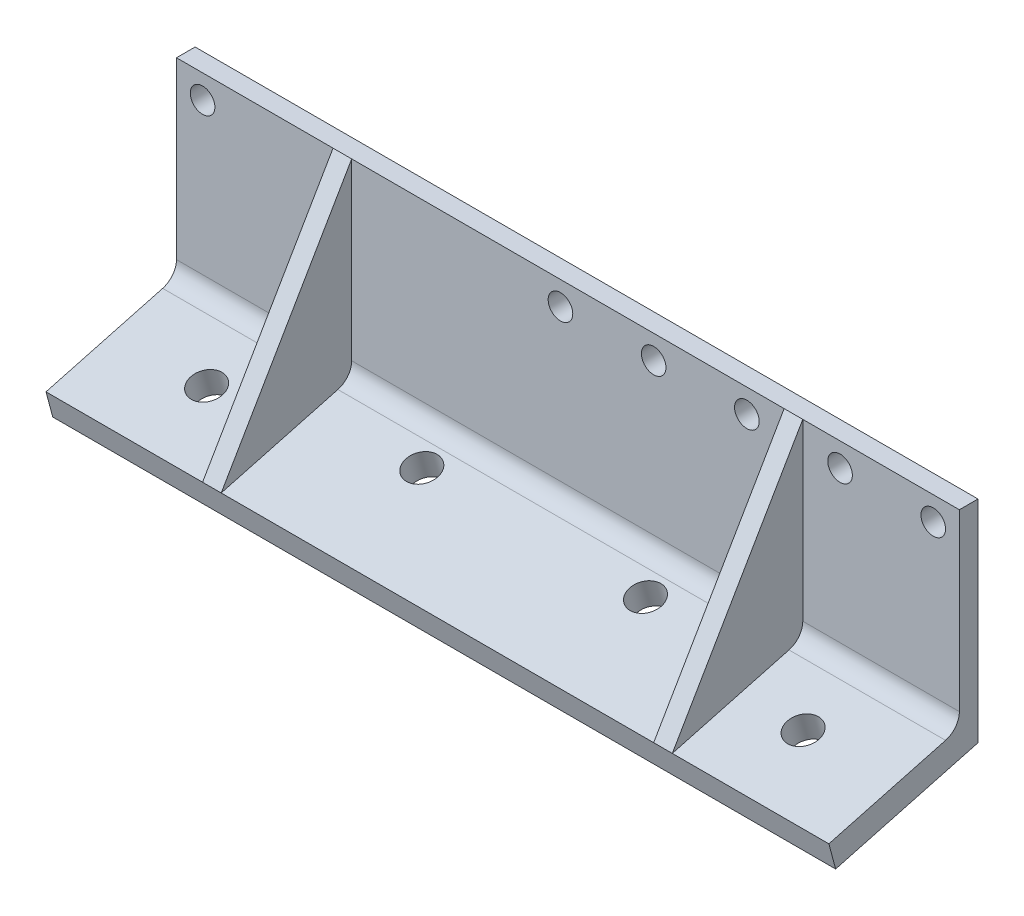
from build123d import *

# Parameters (mm, degrees)
EXTRUDE_1_DEPTH      = 30
SKETCH_2_R           = 44.45
CUT_EXTRUDE_1_DEPTH  = 4
SKETCH_3_R           = 25.5
SKETCH_3_R_2         = 2.25
CUT_EXTRUDE_2_DEPTH  = 188.619295383
CUT_EXTRUDE_3_DEPTH  = 189.215302247
SKETCH_5_R           = 1.65
CUT_EXTRUDE_4_DEPTH  = 189.215302247
EXTRUDE_START        = -30
EXTRUDE_2_DEPTH      = 30
CUT_EXTRUDE_5_DEPTH  = 198.040604952
CUT_EXTRUDE_7_DEPTH  = 233.432785983
CUT_EXTRUDE_8_DEPTH  = 233.432785983
CUT_EXTRUDE_9_DEPTH  = 233.432785983
FILLET_1_R           = 5
CUT_EXTRUDE_10_DEPTH = 233.432785983
EXTRUDE_START_2      = -5
EXTRUDE_3_DEPTH      = 5
EXTRUDE_4_DEPTH      = 5
SKETCH_14_R          = 4.25
CUT_EXTRUDE_11_DEPTH = 189.364728478
SKETCH_16_W          = 43
SKETCH_16_H          = 30
CUT_EXTRUDE_12_DEPTH = 233.432785983
EXTRUDE_7_REACH      = 188.592
SKETCH_18_W          = 210
SKETCH_18_H          = 5
EXTRUDE_8_DEPTH      = 210
EXTRUDE_9_DEPTH      = 5
EXTRUDE_10_DEPTH     = 5
SKETCH_22_R          = 4.25
CUT_EXTRUDE_13_DEPTH = 187.984035343
FILLET_2_R           = 5
SKETCH_23_W          = 158.512158041
SKETCH_23_H          = 103.317713915
CUT_EXTRUDE_14_DEPTH = 234.418610938
EXTRUDE_11_DEPTH     = 2.5
EXTRUDE_12_DEPTH     = 2.5
CUT_EXTRUDE_15_DEPTH = 5
CUT_EXTRUDE_START    = -5
CUT_EXTRUDE_16_DEPTH = 5
SKETCH_24_R          = 3.3
CUT_EXTRUDE_17_DEPTH = 166.976648756


with BuildPart() as part:
    # 草图1 → 凸台-拉伸1 (new body)
    with BuildSketch(Plane(origin=(0, 0, 0), x_dir=(1, 0, 0), z_dir=(0, 1, 0))):
        with BuildLine():
            Line((170, 31.93), (170, -31.93))
            ThreePointArc((170, -31.93), (167.781993847, -38.210172909), (162.111885646, -41.704453387))
            Line((162.111885646, -41.704453387), (15.839142344, -73.308400404))
            ThreePointArc((15.839142344, -73.308400404), (-75, 0), (15.839142344, 73.308400404))
            Line((15.839142344, 73.308400404), (162.111885646, 41.704453387))
            ThreePointArc((162.111885646, 41.704453387), (167.781993847, 38.210172909), (170, 31.93))
        make_face()
    extrude(amount=EXTRUDE_1_DEPTH)

    # 草图2 → 切除-拉伸1 (cut)
    with BuildSketch(Plane(origin=(0, 30, 0), x_dir=(1, 0, 0), z_dir=(0, 1, 0))):
        with Locations(Location((0, 0, 0), (0, 0, 270))):
            Circle(SKETCH_2_R)
    extrude(amount=-CUT_EXTRUDE_1_DEPTH, mode=Mode.SUBTRACT)

    # 草图3 → 切除-拉伸2 (cut, through all)
    with BuildSketch(Plane(origin=(0, 26, 0), x_dir=(1, 0, 0), z_dir=(0, 1, 0))):
        with Locations(Location((0, 0, 0), (0, 0, 270))):
            Circle(SKETCH_3_R)
        with Locations(Location((0, 41, 0), (0, 0, 270))):
            Circle(SKETCH_3_R_2)
        with Locations(Location((28.991378029, 28.991378029, 0), (0, 0, 270))):
            Circle(SKETCH_3_R_2)
        with Locations(Location((41, 0, 0), (0, 0, 270))):
            Circle(SKETCH_3_R_2)
        with Locations(Location((28.991378029, -28.991378029, 0), (0, 0, 270))):
            Circle(SKETCH_3_R_2)
        with Locations(Location((0, -41, 0), (0, 0, 270))):
            Circle(SKETCH_3_R_2)
        with Locations(Location((-28.991378029, -28.991378029, 0), (0, 0, 270))):
            Circle(SKETCH_3_R_2)
        with Locations(Location((-41, 0, 0), (0, 0, 270))):
            Circle(SKETCH_3_R_2)
        with Locations(Location((-28.991378029, 28.991378029, 0), (0, 0, 270))):
            Circle(SKETCH_3_R_2)
    extrude(amount=-CUT_EXTRUDE_2_DEPTH, mode=Mode.SUBTRACT)

    # 草图4 → 切除-拉伸3 (cut, through all)
    with BuildSketch(Plane(origin=(0, 30, 0), x_dir=(1, 0, 0), z_dir=(0, 1, 0))):
        with BuildLine():
            Line((124, 18.5), (134, 18.5))
            ThreePointArc((134, 18.5), (152.5, 0), (134, -18.5))
            Line((134, -18.5), (124, -18.5))
            ThreePointArc((124, -18.5), (105.5, 0), (124, 18.5))
        make_face()
    extrude(amount=-CUT_EXTRUDE_3_DEPTH, mode=Mode.SUBTRACT)

    # 草图5 → 切除-拉伸4 (cut, through all)
    with BuildSketch(Plane(origin=(0, 30, 0), x_dir=(1, 0, 0), z_dir=(0, 1, 0))):
        with Locations(Location((116.75, 25.5, 0), (0, 0, 270))):
            Circle(SKETCH_5_R)
        with Locations(Location((141.25, 25.5, 0), (0, 0, 270))):
            Circle(SKETCH_5_R)
        with Locations(Location((141.25, -25.5, 0), (0, 0, 270))):
            Circle(SKETCH_5_R)
        with Locations(Location((116.75, -25.5, 0), (0, 0, 270))):
            Circle(SKETCH_5_R)
    extrude(amount=-CUT_EXTRUDE_4_DEPTH, mode=Mode.SUBTRACT)

    # 草图6 → 凸台-拉伸2 (add)
    with BuildSketch(Plane(origin=(0, 30, 0), x_dir=(1, 0, 0), z_dir=(0, 1, 0)).offset(EXTRUDE_START)):
        with BuildLine():
            Line((158, 95), (-52, 95))
            Line((-52, 95), (-52, 54.046276467))
            ThreePointArc((-52, 54.046276467), (-20.48558667, 72.148047366), (15.839142344, 73.308400404))
            Line((15.839142344, 73.308400404), (158, 42.592874655))
            Line((158, 42.592874655), (158, 95))
        make_face()
        with BuildLine():
            ThreePointArc((15.839142344, -73.308400404), (-20.48558667, -72.148047366), (-52, -54.046276467))
            Line((-52, -54.046276467), (-52, -95))
            Line((-52, -95), (158, -95))
            Line((158, -95), (158, -42.592874655))
            Line((158, -42.592874655), (15.839142344, -73.308400404))
        make_face()
    extrude(amount=EXTRUDE_2_DEPTH)

    # 草图7 → 切除-拉伸5 (cut, through all)
    with BuildSketch(Plane(origin=(0, 30, 0), x_dir=(1, 0, 0), z_dir=(0, 1, 0))):
        with BuildLine():
            Line((-52, 54.046276467), (-52, -54.046276467))
            ThreePointArc((-52, -54.046276467), (-75, 0), (-52, 54.046276467))
        make_face()
        with BuildLine():
            Line((158, 42.592874655), (158, -42.592874655))
            Line((158, -42.592874655), (162.111885646, -41.704453387))
            ThreePointArc((162.111885646, -41.704453387), (167.781993847, -38.210172909), (170, -31.93))
            Line((170, -31.93), (170, 31.93))
            ThreePointArc((170, 31.93), (167.781993847, 38.210172909), (162.111885646, 41.704453387))
            Line((162.111885646, 41.704453387), (158, 42.592874655))
        make_face()
    extrude(amount=-CUT_EXTRUDE_5_DEPTH, mode=Mode.SUBTRACT)

    # 草图9 → 切除-拉伸7 (cut, through all)
    with BuildSketch(Plane.ZY.offset(52)):
        Polygon((-95, 20), (-60, 10.621778265), (-60, 30), (-95, 30), align=None)
    extrude(amount=-CUT_EXTRUDE_7_DEPTH, mode=Mode.SUBTRACT)

    # 草图10 → 切除-拉伸8 (cut, through all)
    with BuildSketch(Plane.ZY.offset(52)):
        Polygon((-95, 12.753066737), (-52, 1.231251463), (-52, 0), (-95, 0), align=None)
    extrude(amount=-CUT_EXTRUDE_8_DEPTH, mode=Mode.SUBTRACT)

    # 草图8 → 切除-拉伸9 (cut, through all)
    with BuildSketch(Plane.ZY.offset(52)):
        Polygon((0, 0), (52, 0), (52, 17.3), (-52, 17.3), (-52, 0), align=None)
    extrude(amount=-CUT_EXTRUDE_9_DEPTH, mode=Mode.SUBTRACT)

    # 圆角1
    fillet_1_edges = [part.edges().sort_by_distance(p)[0] for p in [
        (53, 10.621778265, -60),
    ]]
    fillet(fillet_1_edges, radius=FILLET_1_R)

    # 草图11 → 切除-拉伸10 (cut, through all)
    with BuildSketch(Plane.ZY.offset(52)):
        Polygon((-95, 12.753066737), (-93.188266684, 19.514547521), (-95, 20), align=None)
    extrude(amount=-CUT_EXTRUDE_10_DEPTH, mode=Mode.SUBTRACT)

    # 草图12 → 凸台-拉伸3 (add)
    with BuildSketch(Plane.ZY.offset(52).offset(EXTRUDE_START_2)):
        with BuildLine():
            Line((-93.188266684, 19.514547521), (-60, 30))
            Line((-60, 30), (-60, 17.137905129))
            ThreePointArc((-60, 17.137905129), (-61.956192855, 13.171138428), (-66.294095226, 12.308275998))
            Line((-66.294095226, 12.308275998), (-93.188266684, 19.514547521))
        make_face()
    extrude(amount=EXTRUDE_3_DEPTH)

    # 草图13 → 凸台-拉伸4 (add)
    with BuildSketch(Plane(origin=(158, 0, 0), x_dir=(0, 0, -1), z_dir=(1, 0, 0))):
        with BuildLine():
            Line((66.294095226, 12.308275998), (93.188266684, 19.514547521))
            Line((93.188266684, 19.514547521), (60, 30))
            Line((60, 30), (60, 17.137905129))
            ThreePointArc((60, 17.137905129), (61.956192855, 13.171138428), (66.294095226, 12.308275998))
        make_face()
    extrude(amount=-EXTRUDE_4_DEPTH)

    # 草图14 → 切除-拉伸11 (cut, through all)
    with BuildSketch(Plane(origin=(0, -5.089745962, -1.36379332), x_dir=(1, 0, 0), z_dir=(0, 0.9659258262890681, 0.2588190451025214))):
        with Locations(Location((-27, 82.063690052, 0), (0, 0, 270))):
            Circle(SKETCH_14_R)
        with Locations(Location((23, 82.063690052, 0), (0, 0, 270))):
            Circle(SKETCH_14_R)
        with Locations(Location((83, 82.063690052, 0), (0, 0, 270))):
            Circle(SKETCH_14_R)
        with Locations(Location((133, 82.063690052, 0), (0, 0, 270))):
            Circle(SKETCH_14_R)
    extrude(amount=-CUT_EXTRUDE_11_DEPTH, mode=Mode.SUBTRACT)

    # 草图16 → 切除-拉伸12 (cut, through all)
    with BuildSketch(Plane.ZY.offset(52)):
        with Locations((73.5, 15)):
            Rectangle(SKETCH_16_W, SKETCH_16_H)
    extrude(amount=-CUT_EXTRUDE_12_DEPTH, mode=Mode.SUBTRACT)

    # 凸台-拉伸7: up to this plane
    extrude_7_end = Plane(origin=(0, -11.851226746, -3.175526636), z_dir=(0, -0.9659258262890681, -0.25881904510252146))
    # 草图18 → 凸台-拉伸7 (add, up to the surface)
    with BuildSketch(Plane(origin=(0, 30, 0), x_dir=(1, 0, 0), z_dir=(0, 1, 0)), mode=Mode.PRIVATE) as extrude_7_sk1:
        with Locations((53, -54.5)):
            Rectangle(SKETCH_18_W, SKETCH_18_H)
    extrude_7_tool1 = split(extrude(extrude_7_sk1.sketch, amount=-EXTRUDE_7_REACH, mode=Mode.PRIVATE), bisect_by=extrude_7_end, keep=Keep.BOTH, mode=Mode.PRIVATE)
    add(extrude_7_tool1.solids().sort_by_distance((53, 30, 54.5))[0])

    # 草图19 → 凸台-拉伸8 (add)
    with BuildSketch(Plane.ZY.offset(52)):
        Polygon((57, -27.975210512), (90.188266684, -36.867979769), (92, -30.106498985), (57, -20.72827725), align=None)
    extrude(amount=-EXTRUDE_8_DEPTH)

    # 草图20 → 凸台-拉伸9 (add)
    with BuildSketch(Plane.ZY.offset(52)):
        Polygon((92, -30.106498985), (57, -20.72827725), (57, 30), align=None)
    extrude(amount=-EXTRUDE_9_DEPTH)

    # 草图21 → 凸台-拉伸10 (add)
    with BuildSketch(Plane(origin=(158, 0, 0), x_dir=(0, 0, -1), z_dir=(1, 0, 0))):
        Polygon((-57, 30), (-92, -30.106498985), (-57, -20.72827725), align=None)
    extrude(amount=-EXTRUDE_10_DEPTH)

    # 草图22 → 切除-拉伸13 (cut, through all)
    with BuildSketch(Plane(origin=(0, -5.089745962, -1.36379332), x_dir=(1, 0, 0), z_dir=(0, 0.9659258262890686, 0.25881904510251946))):
        with Locations(Location((-27, -77.936309948, 0), (0, 0, 270))):
            Circle(SKETCH_22_R)
        with Locations(Location((23, -69.936309948, 0), (0, 0, 270))):
            Circle(SKETCH_22_R)
        with Locations(Location((83, -69.936309948, 0), (0, 0, 270))):
            Circle(SKETCH_22_R)
        with Locations(Location((133, -77.936309948, 0), (0, 0, 270))):
            Circle(SKETCH_22_R)
    extrude(amount=-CUT_EXTRUDE_13_DEPTH, mode=Mode.SUBTRACT)

    # 圆角2
    fillet_2_edges = [part.edges().sort_by_distance(p)[0] for p in [
        (53, -20.72827725, 57),
    ]]
    fillet(fillet_2_edges, radius=FILLET_2_R)

    # 草图23 → 切除-拉伸14 (cut, through all)
    with BuildSketch(Plane.ZY.offset(52)):
        with Locations((-27.256079021, 5.306767281)):
            Rectangle(SKETCH_23_W, SKETCH_23_H)
    extrude(amount=-CUT_EXTRUDE_14_DEPTH, mode=Mode.SUBTRACT)

    # 草图25 → 凸台-拉伸11 (add, symmetric)
    with BuildSketch(Plane(origin=(113.5, 0, 0), x_dir=(0, 0, -1), z_dir=(1, 0, 0))):
        with BuildLine():
            Line((-57, -16.89164231), (-57, 30))
            Line((-57, 30), (-92, -30.106498985))
            Line((-92, -30.106498985), (-60.705904774, -21.721271441))
            ThreePointArc((-60.705904774, -21.721271441), (-58.033233299, -19.935449455), (-57, -16.89164231))
        make_face()
    extrude(amount=EXTRUDE_11_DEPTH, both=True)

    # 草图26 → 凸台-拉伸12 (add, symmetric)
    with BuildSketch(Plane.ZY.offset(7.5)):
        with BuildLine():
            Line((60.705904774, -21.721271441), (92, -30.106498985))
            Line((92, -30.106498985), (57, 30))
            Line((57, 30), (57, -16.89164231))
            ThreePointArc((57, -16.89164231), (58.033233299, -19.935449455), (60.705904774, -21.721271441))
        make_face()
    extrude(amount=EXTRUDE_12_DEPTH, both=True)

    # 草图27 → 切除-拉伸15 (cut)
    with BuildSketch(Plane(origin=(-47, 0, 0), x_dir=(0, 0, -1), z_dir=(1, 0, 0))):
        with BuildLine():
            Line((-92, -30.106498985), (-60.705904774, -21.721271441))
            ThreePointArc((-60.705904774, -21.721271441), (-58.033233299, -19.935449455), (-57, -16.89164231))
            Line((-57, -16.89164231), (-57, 30))
            Line((-57, 30), (-92, -30.106498985))
        make_face()
    extrude(amount=-CUT_EXTRUDE_15_DEPTH, mode=Mode.SUBTRACT)

    # 草图28 → 切除-拉伸16 (cut)
    with BuildSketch(Plane.ZY.offset(-153).offset(CUT_EXTRUDE_START)):
        with BuildLine():
            Line((57, 30), (57, -16.89164231))
            ThreePointArc((57, -16.89164231), (58.033233299, -19.935449455), (60.705904774, -21.721271441))
            Line((60.705904774, -21.721271441), (92, -30.106498985))
            Line((92, -30.106498985), (57, 30))
        make_face()
    extrude(amount=CUT_EXTRUDE_16_DEPTH, mode=Mode.SUBTRACT)

    # 草图24 → 切除-拉伸17 (cut, through all)
    with BuildSketch(Plane.XY.offset(57)):
        with Locations((-45, 23.65)):
            Circle(SKETCH_24_R)
        with Locations((151, 23.65)):
            Circle(SKETCH_24_R)
        with Locations((126, 23.65)):
            Circle(SKETCH_24_R)
        with Locations((101, 23.65)):
            Circle(SKETCH_24_R)
        with Locations((76, 23.65)):
            Circle(SKETCH_24_R)
        with Locations((51, 23.65)):
            Circle(SKETCH_24_R)
    extrude(amount=-CUT_EXTRUDE_17_DEPTH, mode=Mode.SUBTRACT)


solid = part.part
